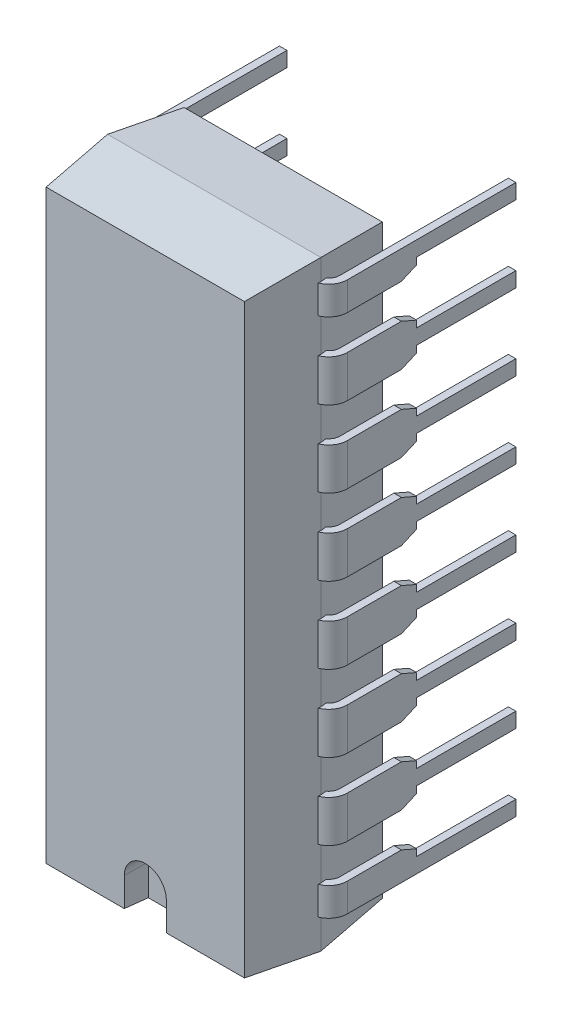
from build123d import *

# Parameters (mm, degrees)
BASIC_SHAPE_DEPTH              = 10
SIDE_PROFILE1_DEPTH            = 12.773380993
SIDE_PROFILE1_DEPTH_BACK       = 12.773380993
SIDE_PROFILE2_DEPTH            = 12.773380993
SIDE_PROFILE2_DEPTH_BACK       = 12.773380993
LOCATION_MARK_DEPTH            = 0.8
SKETCH6_W                      = 0.25
SKETCH6_H                      = 1.39
PIN_RELIEF_DEPTH               = 14.354970049
REMAINING_PINS_COUNT           = 8
REMAINING_PINS_PITCH           = 2.54
REMAINING_PINS_COPY_1_SKETCH_W = 0.25
REMAINING_PINS_COPY_1_SKETCH_H = 1.39
REMAINING_PINS_COPY_2_SKETCH_W = 0.25
REMAINING_PINS_COPY_2_SKETCH_H = 1.39
REMAINING_PINS_COPY_3_SKETCH_W = 0.25
REMAINING_PINS_COPY_3_SKETCH_H = 1.39
REMAINING_PINS_COPY_4_SKETCH_W = 0.25
REMAINING_PINS_COPY_4_SKETCH_H = 1.39
REMAINING_PINS_COPY_5_SKETCH_W = 0.25
REMAINING_PINS_COPY_5_SKETCH_H = 1.39
REMAINING_PINS_COPY_6_SKETCH_W = 0.25
REMAINING_PINS_COPY_6_SKETCH_H = 1.39
REMAINING_PINS_COPY_7_SKETCH_W = 0.25
REMAINING_PINS_COPY_7_SKETCH_H = 1.39
REMAINING_PINS_COPY_8_DEPTH    = 14.354970049
REMAINING_PINS_COPY_9_DEPTH    = 14.354970049
REMAINING_PINS_COPY_10_DEPTH   = 14.354970049
REMAINING_PINS_COPY_11_DEPTH   = 14.354970049
REMAINING_PINS_COPY_12_DEPTH   = 14.354970049
REMAINING_PINS_COPY_13_DEPTH   = 14.354970049
REMAINING_PINS_COPY_14_DEPTH   = 14.354970049
PIN_RELIEF1_DEPTH              = 0.445
PIN_RELIEF2_DEPTH              = 0.445


with BuildPart() as part:
    # Sketch1 → Basic Shape (new, symmetric)
    with BuildSketch(Plane(origin=(0, 0, 0), x_dir=(1, 0, 0), z_dir=(0, 1, 0))):
        Polygon((-3.3, -5.1), (-3.55, -2.805), (-3.3, -0.51), (3.3, -0.51), (3.55, -2.805), (3.3, -5.1), align=None)
    extrude(amount=BASIC_SHAPE_DEPTH, both=True)

    # Sketch2 → Side Profile1 (cut, two sides: drawn at the far end of the back side and taken through both)
    with BuildSketch(Plane(origin=(0, 0, 0), x_dir=(0, 0, -1), z_dir=(1, 0, 0)).offset(-SIDE_PROFILE1_DEPTH_BACK)):
        Polygon((-0.51, 10), (-0.51, 9.75), (-2.805, 10), align=None)
        Polygon((-0.51, -10), (-2.805, -10), (-0.51, -9.75), align=None)
    extrude(amount=SIDE_PROFILE1_DEPTH + SIDE_PROFILE1_DEPTH_BACK, mode=Mode.SUBTRACT)

    # Sketch3 → Side Profile2 (cut, two sides: drawn at the far end of the back side and taken through both)
    with BuildSketch(Plane(origin=(0, 0, 0), x_dir=(0, 0, -1), z_dir=(1, 0, 0)).offset(-SIDE_PROFILE2_DEPTH_BACK)):
        Polygon((-2.805, 10), (-5.1, 10), (-5.1, 9.75), align=None)
        Polygon((-2.805, -10), (-5.1, -10), (-5.1, -9.75), align=None)
    extrude(amount=SIDE_PROFILE2_DEPTH + SIDE_PROFILE2_DEPTH_BACK, mode=Mode.SUBTRACT)

    # Sketch4 → Location Mark (cut)
    with BuildSketch(Plane.XY.offset(5.1)):
        with BuildLine():
            Line((-0.7, -10), (-0.7, -8.8))
            ThreePointArc((-0.7, -8.8), (0, -8.1), (0.7, -8.8))
            Line((0.7, -8.8), (0.7, -10))
            Line((0.7, -10), (-0.7, -10))
        make_face()
    extrude(amount=-LOCATION_MARK_DEPTH, mode=Mode.SUBTRACT)

    # First Pin: sweep along a path in Sketch5
    with BuildLine(Plane(origin=(0, -8.73, 0), x_dir=(1, 0, 0), z_dir=(0, 1, 0))) as first_pin_path:
        Line((0, -2.805), (3.31, -2.805))
        ThreePointArc((3.31, -2.805), (3.663553391, -2.658553391), (3.81, -2.305))
        Line((3.81, -2.305), (3.81, 3.3))
    # Sketch6 → First Pin (sweep)
    with BuildSketch(Plane(origin=(0, 0, 0), x_dir=(0, 0, -1), z_dir=(1, 0, 0))):
        with Locations((-2.805, -8.73)):
            Rectangle(SKETCH6_W, SKETCH6_H)
    first_pin = sweep(path=first_pin_path.line)

    # Sketch7 → Pin Relief (cut, through all)
    with BuildSketch(Plane.ZY.offset(-3.685)):
        Polygon((-3.3, -8.98), (0, -8.98), (0, -9.2025), (0.51, -9.425), (-3.3, -9.425), align=None)
        Polygon((-3.3, -8.48), (0, -8.48), (0, -8.2575), (0.51, -8.035), (-3.3, -8.035), align=None)
    pin_relief = extrude(amount=-PIN_RELIEF_DEPTH, mode=Mode.SUBTRACT)

    # Opp Pin: First Pin, Pin Relief across plane
    add(first_pin.mirror(Plane(origin=(0, 0, 0), x_dir=(0, 0, 1), z_dir=(1, 0, 0))))
    add(pin_relief.mirror(Plane(origin=(0, 0, 0), x_dir=(0, 0, 1), z_dir=(1, 0, 0))), mode=Mode.SUBTRACT)

    # Remaining Pins: First Pin, Pin Relief ×8
    with Locations(*[(0, i * REMAINING_PINS_PITCH, 0) for i in range(1, REMAINING_PINS_COUNT)]):
        add(first_pin)
        add(pin_relief, mode=Mode.SUBTRACT)

    # Remaining Pins copy 1: sweep along a path in Remaining Pins copy 1 path
    with BuildLine(Plane(origin=(0, -6.19, 0), x_dir=(-1, 0, 0), z_dir=(0, 1, 0))) as remaining_pins_copy_1_path:
        Line((0, 2.805), (3.31, 2.805))
        ThreePointArc((3.31, 2.805), (3.663553391, 2.658553391), (3.81, 2.305))
        Line((3.81, 2.305), (3.81, -3.3))
    # Remaining Pins copy 1 sketch → Remaining Pins copy 1 (sweep)
    with BuildSketch(Plane(origin=(0, 2.54, 0), x_dir=(0, 0, -1), z_dir=(-1, 0, 0))):
        with Locations((-2.805, 8.73)):
            Rectangle(REMAINING_PINS_COPY_1_SKETCH_W, REMAINING_PINS_COPY_1_SKETCH_H)
    sweep(path=remaining_pins_copy_1_path.line)

    # Remaining Pins copy 2: sweep along a path in Remaining Pins copy 2 path
    with BuildLine(Plane(origin=(0, -3.65, 0), x_dir=(-1, 0, 0), z_dir=(0, 1, 0))) as remaining_pins_copy_2_path:
        Line((0, 2.805), (3.31, 2.805))
        ThreePointArc((3.31, 2.805), (3.663553391, 2.658553391), (3.81, 2.305))
        Line((3.81, 2.305), (3.81, -3.3))
    # Remaining Pins copy 2 sketch → Remaining Pins copy 2 (sweep)
    with BuildSketch(Plane(origin=(0, 5.08, 0), x_dir=(0, 0, -1), z_dir=(-1, 0, 0))):
        with Locations((-2.805, 8.73)):
            Rectangle(REMAINING_PINS_COPY_2_SKETCH_W, REMAINING_PINS_COPY_2_SKETCH_H)
    sweep(path=remaining_pins_copy_2_path.line)

    # Remaining Pins copy 3: sweep along a path in Remaining Pins copy 3 path
    with BuildLine(Plane(origin=(0, -1.11, 0), x_dir=(-1, 0, 0), z_dir=(0, 1, 0))) as remaining_pins_copy_3_path:
        Line((0, 2.805), (3.31, 2.805))
        ThreePointArc((3.31, 2.805), (3.663553391, 2.658553391), (3.81, 2.305))
        Line((3.81, 2.305), (3.81, -3.3))
    # Remaining Pins copy 3 sketch → Remaining Pins copy 3 (sweep)
    with BuildSketch(Plane(origin=(0, 7.62, 0), x_dir=(0, 0, -1), z_dir=(-1, 0, 0))):
        with Locations((-2.805, 8.73)):
            Rectangle(REMAINING_PINS_COPY_3_SKETCH_W, REMAINING_PINS_COPY_3_SKETCH_H)
    sweep(path=remaining_pins_copy_3_path.line)

    # Remaining Pins copy 4: sweep along a path in Remaining Pins copy 4 path
    with BuildLine(Plane(origin=(0, 1.43, 0), x_dir=(-1, 0, 0), z_dir=(0, 1, 0))) as remaining_pins_copy_4_path:
        Line((0, 2.805), (3.31, 2.805))
        ThreePointArc((3.31, 2.805), (3.663553391, 2.658553391), (3.81, 2.305))
        Line((3.81, 2.305), (3.81, -3.3))
    # Remaining Pins copy 4 sketch → Remaining Pins copy 4 (sweep)
    with BuildSketch(Plane(origin=(0, 10.16, 0), x_dir=(0, 0, -1), z_dir=(-1, 0, 0))):
        with Locations((-2.805, 8.73)):
            Rectangle(REMAINING_PINS_COPY_4_SKETCH_W, REMAINING_PINS_COPY_4_SKETCH_H)
    sweep(path=remaining_pins_copy_4_path.line)

    # Remaining Pins copy 5: sweep along a path in Remaining Pins copy 5 path
    with BuildLine(Plane(origin=(0, 3.97, 0), x_dir=(-1, 0, 0), z_dir=(0, 1, 0))) as remaining_pins_copy_5_path:
        Line((0, 2.805), (3.31, 2.805))
        ThreePointArc((3.31, 2.805), (3.663553391, 2.658553391), (3.81, 2.305))
        Line((3.81, 2.305), (3.81, -3.3))
    # Remaining Pins copy 5 sketch → Remaining Pins copy 5 (sweep)
    with BuildSketch(Plane(origin=(0, 12.7, 0), x_dir=(0, 0, -1), z_dir=(-1, 0, 0))):
        with Locations((-2.805, 8.73)):
            Rectangle(REMAINING_PINS_COPY_5_SKETCH_W, REMAINING_PINS_COPY_5_SKETCH_H)
    sweep(path=remaining_pins_copy_5_path.line)

    # Remaining Pins copy 6: sweep along a path in Remaining Pins copy 6 path
    with BuildLine(Plane(origin=(0, 6.51, 0), x_dir=(-1, 0, 0), z_dir=(0, 1, 0))) as remaining_pins_copy_6_path:
        Line((0, 2.805), (3.31, 2.805))
        ThreePointArc((3.31, 2.805), (3.663553391, 2.658553391), (3.81, 2.305))
        Line((3.81, 2.305), (3.81, -3.3))
    # Remaining Pins copy 6 sketch → Remaining Pins copy 6 (sweep)
    with BuildSketch(Plane(origin=(0, 15.24, 0), x_dir=(0, 0, -1), z_dir=(-1, 0, 0))):
        with Locations((-2.805, 8.73)):
            Rectangle(REMAINING_PINS_COPY_6_SKETCH_W, REMAINING_PINS_COPY_6_SKETCH_H)
    sweep(path=remaining_pins_copy_6_path.line)

    # Remaining Pins copy 7: sweep along a path in Remaining Pins copy 7 path
    with BuildLine(Plane(origin=(0, 9.05, 0), x_dir=(-1, 0, 0), z_dir=(0, 1, 0))) as remaining_pins_copy_7_path:
        Line((0, 2.805), (3.31, 2.805))
        ThreePointArc((3.31, 2.805), (3.663553391, 2.658553391), (3.81, 2.305))
        Line((3.81, 2.305), (3.81, -3.3))
    # Remaining Pins copy 7 sketch → Remaining Pins copy 7 (sweep)
    with BuildSketch(Plane(origin=(0, 17.78, 0), x_dir=(0, 0, -1), z_dir=(-1, 0, 0))):
        with Locations((-2.805, 8.73)):
            Rectangle(REMAINING_PINS_COPY_7_SKETCH_W, REMAINING_PINS_COPY_7_SKETCH_H)
    sweep(path=remaining_pins_copy_7_path.line)

    # Remaining Pins copy 8 sketch → Remaining Pins copy 8 (cut, through all)
    with BuildSketch(Plane(origin=(-3.685, 2.54, 0), x_dir=(0, 0, 1), z_dir=(1, 0, 0))):
        Polygon((-3.3, 8.98), (0, 8.98), (0, 9.2025), (0.51, 9.425), (-3.3, 9.425), align=None)
        Polygon((-3.3, 8.48), (0, 8.48), (0, 8.2575), (0.51, 8.035), (-3.3, 8.035), align=None)
    extrude(amount=-REMAINING_PINS_COPY_8_DEPTH, mode=Mode.SUBTRACT)

    # Remaining Pins copy 9 sketch → Remaining Pins copy 9 (cut, through all)
    with BuildSketch(Plane(origin=(-3.685, 5.08, 0), x_dir=(0, 0, 1), z_dir=(1, 0, 0))):
        Polygon((-3.3, 8.98), (0, 8.98), (0, 9.2025), (0.51, 9.425), (-3.3, 9.425), align=None)
        Polygon((-3.3, 8.48), (0, 8.48), (0, 8.2575), (0.51, 8.035), (-3.3, 8.035), align=None)
    extrude(amount=-REMAINING_PINS_COPY_9_DEPTH, mode=Mode.SUBTRACT)

    # Remaining Pins copy 10 sketch → Remaining Pins copy 10 (cut, through all)
    with BuildSketch(Plane(origin=(-3.685, 7.62, 0), x_dir=(0, 0, 1), z_dir=(1, 0, 0))):
        Polygon((-3.3, 8.98), (0, 8.98), (0, 9.2025), (0.51, 9.425), (-3.3, 9.425), align=None)
        Polygon((-3.3, 8.48), (0, 8.48), (0, 8.2575), (0.51, 8.035), (-3.3, 8.035), align=None)
    extrude(amount=-REMAINING_PINS_COPY_10_DEPTH, mode=Mode.SUBTRACT)

    # Remaining Pins copy 11 sketch → Remaining Pins copy 11 (cut, through all)
    with BuildSketch(Plane(origin=(-3.685, 10.16, 0), x_dir=(0, 0, 1), z_dir=(1, 0, 0))):
        Polygon((-3.3, 8.98), (0, 8.98), (0, 9.2025), (0.51, 9.425), (-3.3, 9.425), align=None)
        Polygon((-3.3, 8.48), (0, 8.48), (0, 8.2575), (0.51, 8.035), (-3.3, 8.035), align=None)
    extrude(amount=-REMAINING_PINS_COPY_11_DEPTH, mode=Mode.SUBTRACT)

    # Remaining Pins copy 12 sketch → Remaining Pins copy 12 (cut, through all)
    with BuildSketch(Plane(origin=(-3.685, 12.7, 0), x_dir=(0, 0, 1), z_dir=(1, 0, 0))):
        Polygon((-3.3, 8.98), (0, 8.98), (0, 9.2025), (0.51, 9.425), (-3.3, 9.425), align=None)
        Polygon((-3.3, 8.48), (0, 8.48), (0, 8.2575), (0.51, 8.035), (-3.3, 8.035), align=None)
    extrude(amount=-REMAINING_PINS_COPY_12_DEPTH, mode=Mode.SUBTRACT)

    # Remaining Pins copy 13 sketch → Remaining Pins copy 13 (cut, through all)
    with BuildSketch(Plane(origin=(-3.685, 15.24, 0), x_dir=(0, 0, 1), z_dir=(1, 0, 0))):
        Polygon((-3.3, 8.98), (0, 8.98), (0, 9.2025), (0.51, 9.425), (-3.3, 9.425), align=None)
        Polygon((-3.3, 8.48), (0, 8.48), (0, 8.2575), (0.51, 8.035), (-3.3, 8.035), align=None)
    extrude(amount=-REMAINING_PINS_COPY_13_DEPTH, mode=Mode.SUBTRACT)

    # Remaining Pins copy 14 sketch → Remaining Pins copy 14 (cut, through all)
    with BuildSketch(Plane(origin=(-3.685, 17.78, 0), x_dir=(0, 0, 1), z_dir=(1, 0, 0))):
        Polygon((-3.3, 8.98), (0, 8.98), (0, 9.2025), (0.51, 9.425), (-3.3, 9.425), align=None)
        Polygon((-3.3, 8.48), (0, 8.48), (0, 8.2575), (0.51, 8.035), (-3.3, 8.035), align=None)
    extrude(amount=-REMAINING_PINS_COPY_14_DEPTH, mode=Mode.SUBTRACT)

    # Sketch9 → Pin Relief1 (cut)
    with BuildSketch(Plane.XZ.offset(9.425)):
        with BuildLine():
            Line((3.935, 0), (3.685, 0))
            Line((3.685, 0), (3.685, 2.305))
            ThreePointArc((3.685, 2.305), (3.64364911, 2.476181984), (3.528715885, 2.609611821))
            Line((3.528715885, 2.609611821), (3.55, 2.805))
            Line((3.55, 2.805), (3.541213578, 2.88565935))
            ThreePointArc((3.541213578, 2.88565935), (3.827268541, 2.655796603), (3.935, 2.305))
            Line((3.935, 2.305), (3.935, 0))
        make_face()
        with BuildLine():
            Line((-3.935, 0), (-3.685, 0))
            Line((-3.685, 0), (-3.685, 2.305))
            ThreePointArc((-3.685, 2.305), (-3.64364911, 2.476181984), (-3.528715885, 2.609611821))
            Line((-3.528715885, 2.609611821), (-3.55, 2.805))
            Line((-3.55, 2.805), (-3.541213578, 2.88565935))
            ThreePointArc((-3.541213578, 2.88565935), (-3.827268541, 2.655796603), (-3.935, 2.305))
            Line((-3.935, 2.305), (-3.935, 0))
        make_face()
    extrude(amount=-PIN_RELIEF1_DEPTH, mode=Mode.SUBTRACT)

    # Sketch10 → Pin Relief2 (cut)
    with BuildSketch(Plane(origin=(0, 9.745, 0), x_dir=(-1, 0, 0), z_dir=(0, 1, 0))):
        with BuildLine():
            Line((3.935, 0), (3.685, 0))
            Line((3.685, 0), (3.685, 2.305))
            ThreePointArc((3.685, 2.305), (3.64364911, 2.476181984), (3.528715885, 2.609611821))
            Line((3.528715885, 2.609611821), (3.55, 2.805))
            Line((3.55, 2.805), (3.541213578, 2.88565935))
            ThreePointArc((3.541213578, 2.88565935), (3.827268541, 2.655796603), (3.935, 2.305))
            Line((3.935, 2.305), (3.935, 0))
        make_face()
        with BuildLine():
            Line((-3.935, 0), (-3.685, 0))
            Line((-3.685, 0), (-3.685, 2.305))
            ThreePointArc((-3.685, 2.305), (-3.64364911, 2.476181984), (-3.528715885, 2.609611821))
            Line((-3.528715885, 2.609611821), (-3.55, 2.805))
            Line((-3.55, 2.805), (-3.541213578, 2.88565935))
            ThreePointArc((-3.541213578, 2.88565935), (-3.827268541, 2.655796603), (-3.935, 2.305))
            Line((-3.935, 2.305), (-3.935, 0))
        make_face()
    extrude(amount=-PIN_RELIEF2_DEPTH, mode=Mode.SUBTRACT)


solid = part.part
